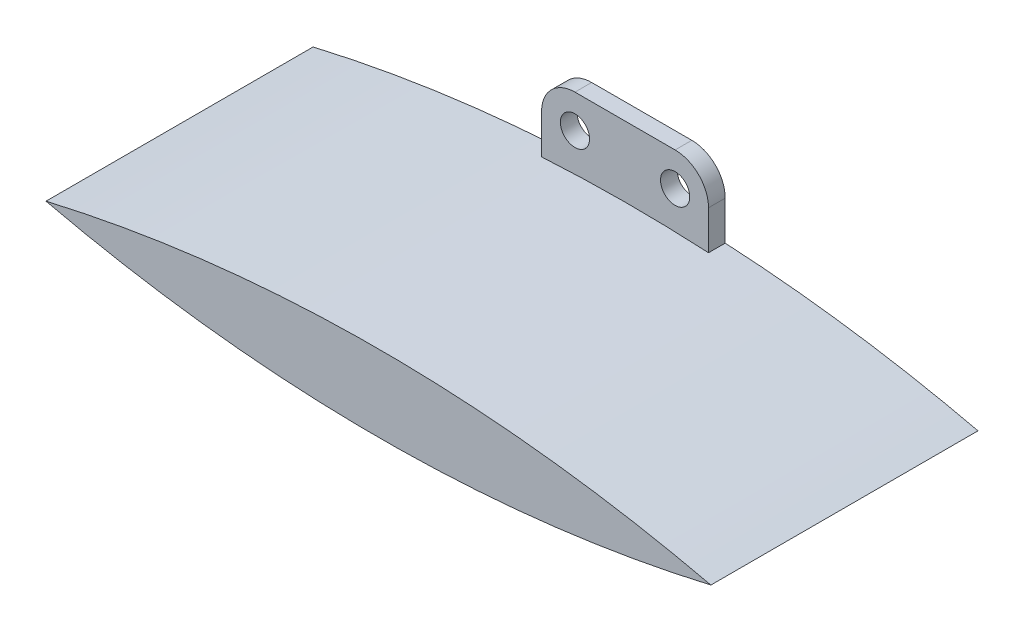
from build123d import *

# Parameters (mm, degrees)
ESQUISSE1_R        = 1.75
BOSS_EXTRU_1_DEPTH = 2
BOSS_EXTRU_2_DEPTH = 30


with BuildPart() as part:
    # Esquisse1 → Boss.-Extru.1 (new body)
    with BuildSketch(Plane.XY):
        with BuildLine():
            Line((-13.285014649, -0.29563378), (-13.285014649, -5.016414934))
            ThreePointArc((-13.285014649, -5.016414934), (-12.113441773, -7.844842058), (-9.285014649, -9.016414934))
            Line((-9.285014649, -9.016414934), (2.714985351, -9.016414934))
            ThreePointArc((2.714985351, -9.016414934), (5.543412476, -7.844842058), (6.714985351, -5.016414934))
            Line((6.714985351, -5.016414934), (6.714985351, -0.348036487))
            ThreePointArc((6.714985351, -0.348036487), (21.951660894, 1.154765906), (36.998669859, 3.983585066))
            ThreePointArc((36.998669859, 3.983585066), (21.951660894, 6.812404226), (6.714985351, 8.315206619))
            Line((6.714985351, 8.315206619), (6.714985351, 12.983585066))
            ThreePointArc((6.714985351, 12.983585066), (5.543412476, 15.812012191), (2.714985351, 16.983585066))
            Line((2.714985351, 16.983585066), (-9.285014649, 16.983585066))
            ThreePointArc((-9.285014649, 16.983585066), (-12.113441773, 15.812012191), (-13.285014649, 12.983585066))
            Line((-13.285014649, 12.983585066), (-13.285014649, 8.262803913))
            ThreePointArc((-13.285014649, 8.262803913), (-28.0599618, 6.746885729), (-42.653153387, 3.983585066))
            ThreePointArc((-42.653153387, 3.983585066), (-28.0599618, 1.220284404), (-13.285014649, -0.29563378))
        make_face()
        with Locations((-9.285014649, 12.983585066)):
            Circle(ESQUISSE1_R, mode=Mode.SUBTRACT)
        with Locations((-9.285014649, -5.016414934)):
            Circle(ESQUISSE1_R, mode=Mode.SUBTRACT)
        with Locations((2.714985351, -5.016414934)):
            Circle(ESQUISSE1_R, mode=Mode.SUBTRACT)
        with Locations((2.714985351, 12.983585066)):
            Circle(ESQUISSE1_R, mode=Mode.SUBTRACT)
    extrude(amount=BOSS_EXTRU_1_DEPTH)

    # Esquisse2 → Boss.-Extru.2 (add)
    with BuildSketch(Plane.XY.offset(2)):
        with BuildLine():
            ThreePointArc((36.998669859, 3.983585066), (-2.827241764, 8.575554846), (-42.653153387, 3.983585066))
            ThreePointArc((-42.653153387, 3.983585066), (-2.827241764, -0.608384714), (36.998669859, 3.983585066))
        make_face()
    extrude(amount=BOSS_EXTRU_2_DEPTH)


solid = part.part
